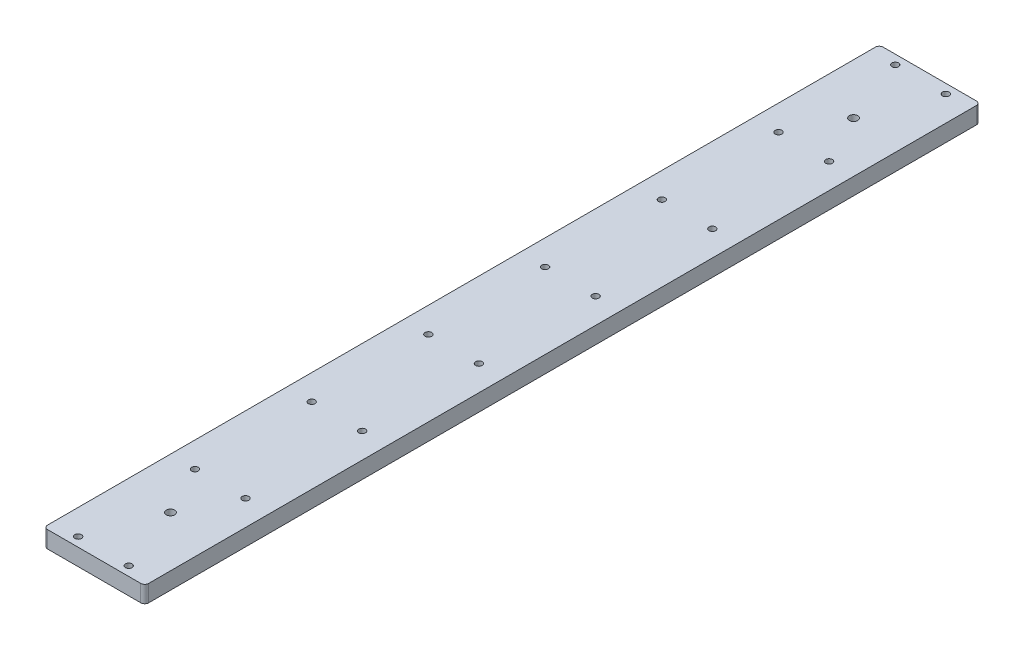
from build123d import *

# Parameters (mm, degrees)
SKETCH1_W           = 76.2
SKETCH1_H           = 12.7
BOSS_EXTRUDE1_DEPTH = 630
SKETCH2_R           = 3.175
CUT_EXTRUDE1_DEPTH  = 632.278781522
SKETCH3_R           = 2.5
CUT_EXTRUDE2_DEPTH  = 632.278781522
FILLET1_R           = 3


with BuildPart() as part:
    # Sketch1 → Boss-Extrude1 (new body)
    with BuildSketch(Plane.XY):
        Rectangle(SKETCH1_W, SKETCH1_H)
    extrude(amount=BOSS_EXTRUDE1_DEPTH)

    # Sketch2 → Cut-Extrude1 (cut, through all)
    with BuildSketch(Plane.XZ.offset(6.35)):
        with Locations(Location((0, 57.5, 0), (0, 0, 270))):
            Circle(SKETCH2_R)
        with Locations(Location((0, 572.5, 0), (0, 0, 270))):
            Circle(SKETCH2_R)
    extrude(amount=-CUT_EXTRUDE1_DEPTH, mode=Mode.SUBTRACT)

    # Sketch3 → Cut-Extrude2 (cut, through all)
    with BuildSketch(Plane.XZ.offset(6.35)):
        with Locations(Location((19.05, 7, 0), (0, 0, 270))):
            Circle(SKETCH3_R)
        with Locations(Location((-19.05, 7, 0), (0, 0, 270))):
            Circle(SKETCH3_R)
        with Locations(Location((-19.05, 95, 0), (0, 0, 270))):
            Circle(SKETCH3_R)
        with Locations(Location((-19.05, 183, 0), (0, 0, 270))):
            Circle(SKETCH3_R)
        with Locations(Location((-19.05, 271, 0), (0, 0, 270))):
            Circle(SKETCH3_R)
        with Locations(Location((-19.05, 359, 0), (0, 0, 270))):
            Circle(SKETCH3_R)
        with Locations(Location((-19.05, 447, 0), (0, 0, 270))):
            Circle(SKETCH3_R)
        with Locations(Location((-19.05, 535, 0), (0, 0, 270))):
            Circle(SKETCH3_R)
        with Locations(Location((-19.05, 623, 0), (0, 0, 270))):
            Circle(SKETCH3_R)
        with Locations(Location((19.05, 95, 0), (0, 0, 270))):
            Circle(SKETCH3_R)
        with Locations(Location((19.05, 183, 0), (0, 0, 270))):
            Circle(SKETCH3_R)
        with Locations(Location((19.05, 271, 0), (0, 0, 270))):
            Circle(SKETCH3_R)
        with Locations(Location((19.05, 359, 0), (0, 0, 270))):
            Circle(SKETCH3_R)
        with Locations(Location((19.05, 447, 0), (0, 0, 270))):
            Circle(SKETCH3_R)
        with Locations(Location((19.05, 535, 0), (0, 0, 270))):
            Circle(SKETCH3_R)
        with Locations(Location((19.05, 623, 0), (0, 0, 270))):
            Circle(SKETCH3_R)
    extrude(amount=-CUT_EXTRUDE2_DEPTH, mode=Mode.SUBTRACT)

    # Fillet1
    fillet1_edges = [part.edges().sort_by_distance(p)[0] for p in [
        (38.1, 0, 630),
        (-38.1, 0, 630),
        (38.1, 0, 0),
        (-38.1, 0, 0),
    ]]
    fillet(fillet1_edges, radius=FILLET1_R)


solid = part.part
